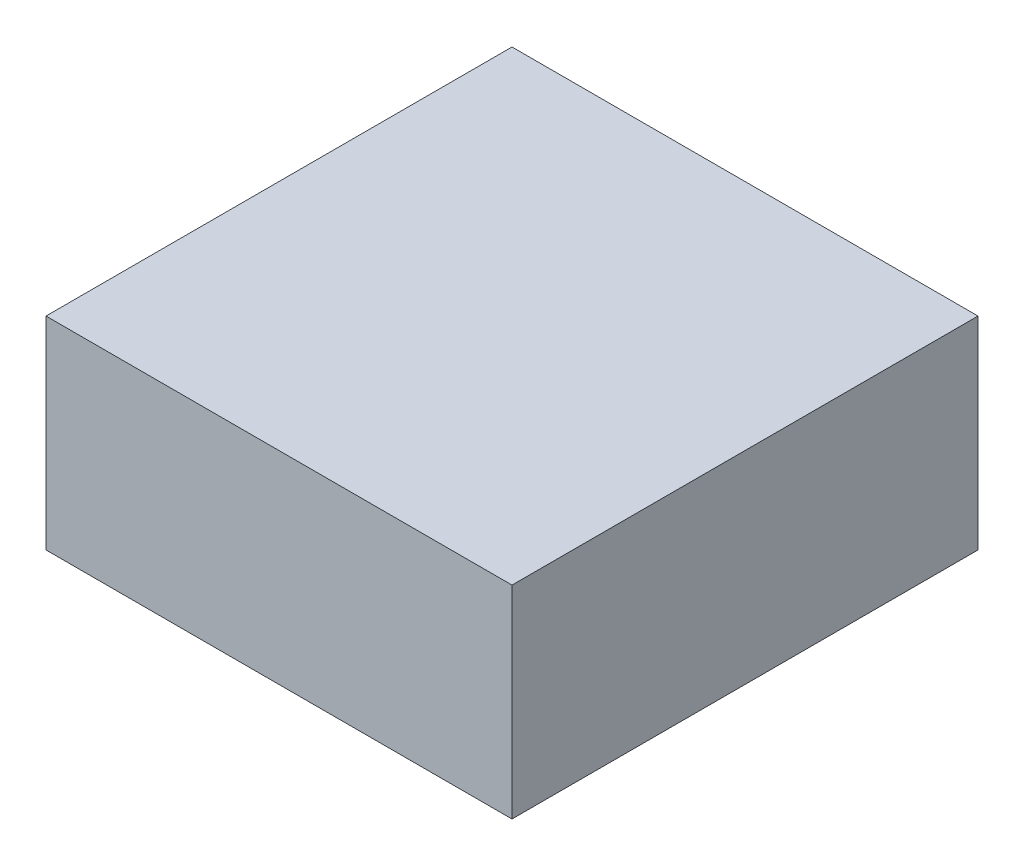
from build123d import *

# Parameters (mm, degrees)
SKETCH1_W           = 230
SKETCH1_H           = 230
BOSS_EXTRUDE1_DEPTH = 100


with BuildPart() as part:
    # Sketch1 → Boss-Extrude1 (new body)
    with BuildSketch(Plane(origin=(0, 0, 0), x_dir=(1, 0, 0), z_dir=(0, 1, 0))):
        Rectangle(SKETCH1_W, SKETCH1_H)
    extrude(amount=BOSS_EXTRUDE1_DEPTH)


solid = part.part
